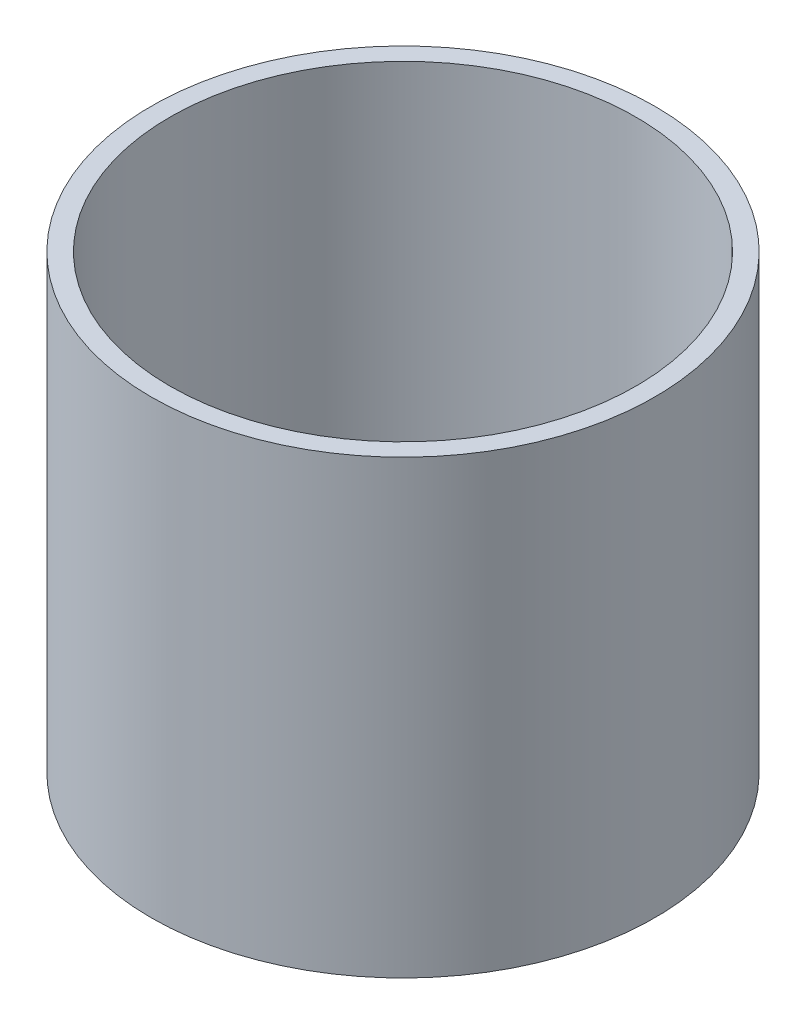
from build123d import *

# Parameters (mm, degrees)
SKETCH1_R           = 33.5
SKETCH1_R_2         = 31
BOSS_EXTRUDE1_DEPTH = 60


with BuildPart() as part:
    # Sketch1 → Boss-Extrude1 (new body)
    with BuildSketch(Plane(origin=(0, 0, 0), x_dir=(1, 0, 0), z_dir=(0, 1, 0))):
        with Locations(Location((0, 0, 0), (0, 0, 270))):
            Circle(SKETCH1_R)
        with Locations(Location((0, 0, 0), (0, 0, 270))):
            Circle(SKETCH1_R_2, mode=Mode.SUBTRACT)
    extrude(amount=BOSS_EXTRUDE1_DEPTH)


solid = part.part
